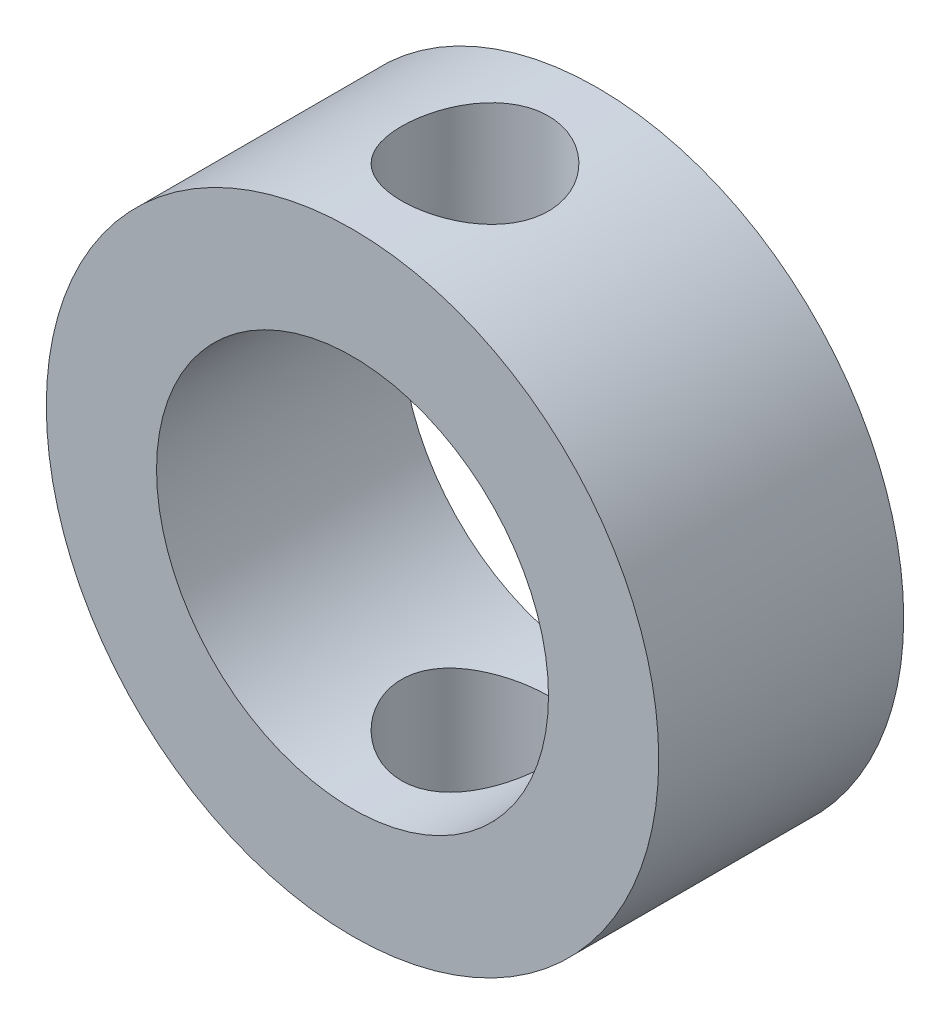
from build123d import *

# Parameters (mm, degrees)
SKETCH1_R           = 12.5
SKETCH1_R_2         = 8
BOSS_EXTRUDE1_DEPTH = 5
SKETCH2_R           = 3
CUT_EXTRUDE1_DEPTH  = 25


with BuildPart() as part:
    # Sketch1 → Boss-Extrude1 (new, symmetric)
    with BuildSketch(Plane.XY):
        Circle(SKETCH1_R)
        Circle(SKETCH1_R_2, mode=Mode.SUBTRACT)
    extrude(amount=BOSS_EXTRUDE1_DEPTH, both=True)

    # Sketch2 → Cut-Extrude1 (cut, symmetric)
    with BuildSketch(Plane(origin=(0, 0, 0), x_dir=(1, 0, 0), z_dir=(0, 1, 0))):
        with Locations(Location((0, 0, 0), (0, 0, 270))):
            Circle(SKETCH2_R)
    extrude(amount=CUT_EXTRUDE1_DEPTH, both=True, mode=Mode.SUBTRACT)


solid = part.part
